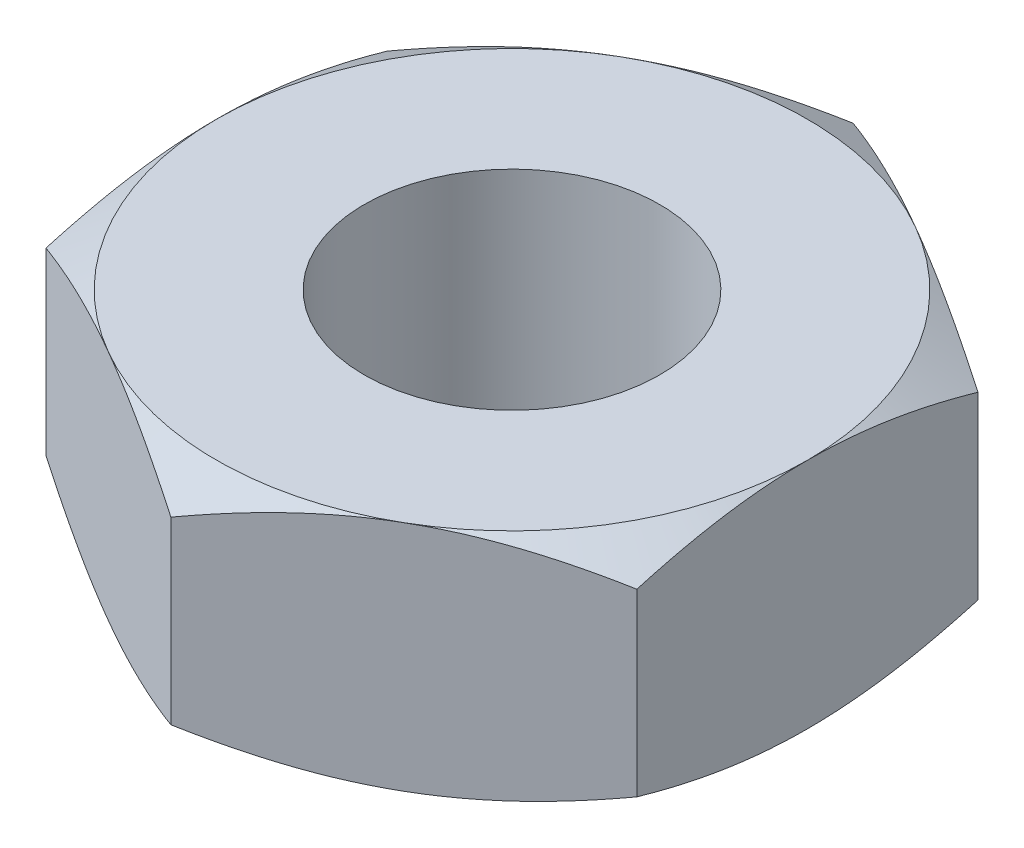
from build123d import *

# Parameters (mm, degrees)
BOSS_EXTRUDE1_DEPTH     = 5
SKETCH2_R               = 6.35
CUT_EXTRUDE1_DEPTH      = 23.47616594
SKETCH3_OUTSIDE_W       = 116.738
SKETCH3_OUTSIDE_H       = 120.668
SKETCH3_OUTSIDE_R       = 12.7
CUT_EXTRUDE2_DEPTH      = 23.47616594
CUT_EXTRUDE2_DRAFT      = -60
MIRROR1_COPY_1_SKETCH_W = 116.738
MIRROR1_COPY_1_SKETCH_H = 120.668
MIRROR1_COPY_1_SKETCH_R = 12.7
MIRROR1_COPY_1_DEPTH    = 23.47616594
MIRROR1_COPY_1_DRAFT    = -60


with BuildPart() as part:
    # Sketch1 → Boss-Extrude1 (new, symmetric)
    with BuildSketch(Plane(origin=(0, 0, 0), x_dir=(1, 0, 0), z_dir=(0, 1, 0))):
        Polygon((-13.788571429, 7.332348419), (-13.788571429, -7.332348419), (-1.088571429, -14.664696837), (11.611428571, -7.332348419), (11.611428571, 7.332348419), (-1.088571429, 14.664696837), align=None)
    extrude(amount=BOSS_EXTRUDE1_DEPTH, both=True)

    # Sketch2 → Cut-Extrude1 (cut, through all)
    with BuildSketch(Plane(origin=(0, 5, 0), x_dir=(1, 0, 0), z_dir=(0, 1, 0))):
        with Locations(Location((-1.088571429, 0, 0), (0, 0, 270))):
            Circle(SKETCH2_R)
    extrude(amount=-CUT_EXTRUDE1_DEPTH, mode=Mode.SUBTRACT)


with BuildPart() as cut_extrude2_tool:
    # Sketch3 outside → Cut-Extrude2 (with draft: the straight prism first)
    with BuildSketch(Plane(origin=(0, 5, 0), x_dir=(1, 0, 0), z_dir=(0, 1, 0))):
        with Locations((-1.089, 0)):
            Rectangle(SKETCH3_OUTSIDE_W, SKETCH3_OUTSIDE_H)
        with Locations((-1.088571429, 0)):
            Circle(SKETCH3_OUTSIDE_R, mode=Mode.SUBTRACT)
    extrude(amount=-CUT_EXTRUDE2_DEPTH)
    # Cut-Extrude2: the draft: its side faces are tilted about the plane it starts from
    cut_extrude2_sides = [cut_extrude2_tool.faces().sort_by_distance(p)[0] for p in [
        (-1.089, -6.73808297, 60.334),
        (57.28, -6.73808297, 0),
        (-1.089, -6.73808297, -60.334),
        (-59.458, -6.73808297, 0),
        (-13.788571429, -6.73808297, 0),
    ]]
    draft(cut_extrude2_sides, Plane(origin=(0, 5, 0), x_dir=(1, 0, 0), z_dir=(0, 1, 0)), CUT_EXTRUDE2_DRAFT)


with BuildPart() as part_1:
    add(part.part)

    # Cut-Extrude2: cut by cut_extrude2_tool
    add(cut_extrude2_tool.part, mode=Mode.SUBTRACT)


with BuildPart() as mirror1_copy_1_tool:
    # Mirror1 copy 1 sketch → Mirror1 copy 1 (with draft: the straight prism first)
    with BuildSketch(Plane.XZ.offset(5)):
        with Locations((-1.089, 0)):
            Rectangle(MIRROR1_COPY_1_SKETCH_W, MIRROR1_COPY_1_SKETCH_H)
        with Locations((-1.088571429, 0)):
            Circle(MIRROR1_COPY_1_SKETCH_R, mode=Mode.SUBTRACT)
    extrude(amount=-MIRROR1_COPY_1_DEPTH)
    # Mirror1 copy 1: the draft: its side faces are tilted about the plane it starts from
    mirror1_copy_1_sides = [mirror1_copy_1_tool.faces().sort_by_distance(p)[0] for p in [
        (-1.089, 6.73808297, 60.334),
        (57.28, 6.73808297, 0),
        (-1.089, 6.73808297, -60.334),
        (-59.458, 6.73808297, 0),
        (-13.788571429, 6.73808297, 0),
    ]]
    draft(mirror1_copy_1_sides, Plane.XZ.offset(5), MIRROR1_COPY_1_DRAFT)


with BuildPart() as part_2:
    add(part_1.part)

    # Mirror1 copy 1: cut by mirror1_copy_1_tool
    add(mirror1_copy_1_tool.part, mode=Mode.SUBTRACT)


solid = part_2.part
